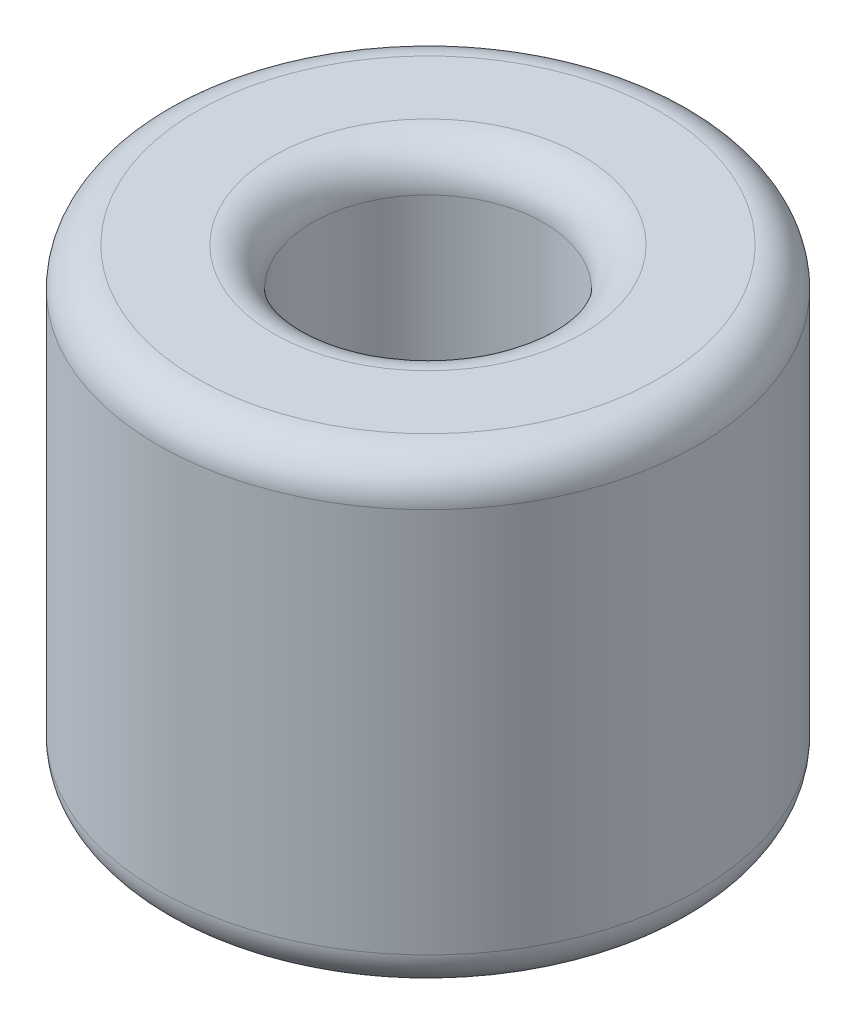
from build123d import *

# Parameters (mm, degrees)
SKETCH1_R           = 3.5
SKETCH1_R_2         = 1.5
BOSS_EXTRUDE1_DEPTH = 6
FILLET1_R           = 0.5


with BuildPart() as part:
    # Sketch1 → Boss-Extrude1 (new body)
    with BuildSketch(Plane(origin=(0, 0, 0), x_dir=(1, 0, 0), z_dir=(0, 1, 0))):
        with Locations(Location((0, 0, 0), (0, 0, 270))):
            Circle(SKETCH1_R)
        with Locations(Location((0, 0, 0), (0, 0, 270))):
            Circle(SKETCH1_R_2, mode=Mode.SUBTRACT)
    extrude(amount=BOSS_EXTRUDE1_DEPTH)

    # Fillet1
    fillet1_edges = [part.edges().sort_by_distance(p)[0] for p in [
        (0, 0, -3.5),
        (0, 6, -3.5),
        (0, 0, -1.5),
        (0, 6, -1.5),
    ]]
    fillet(fillet1_edges, radius=FILLET1_R)


solid = part.part
